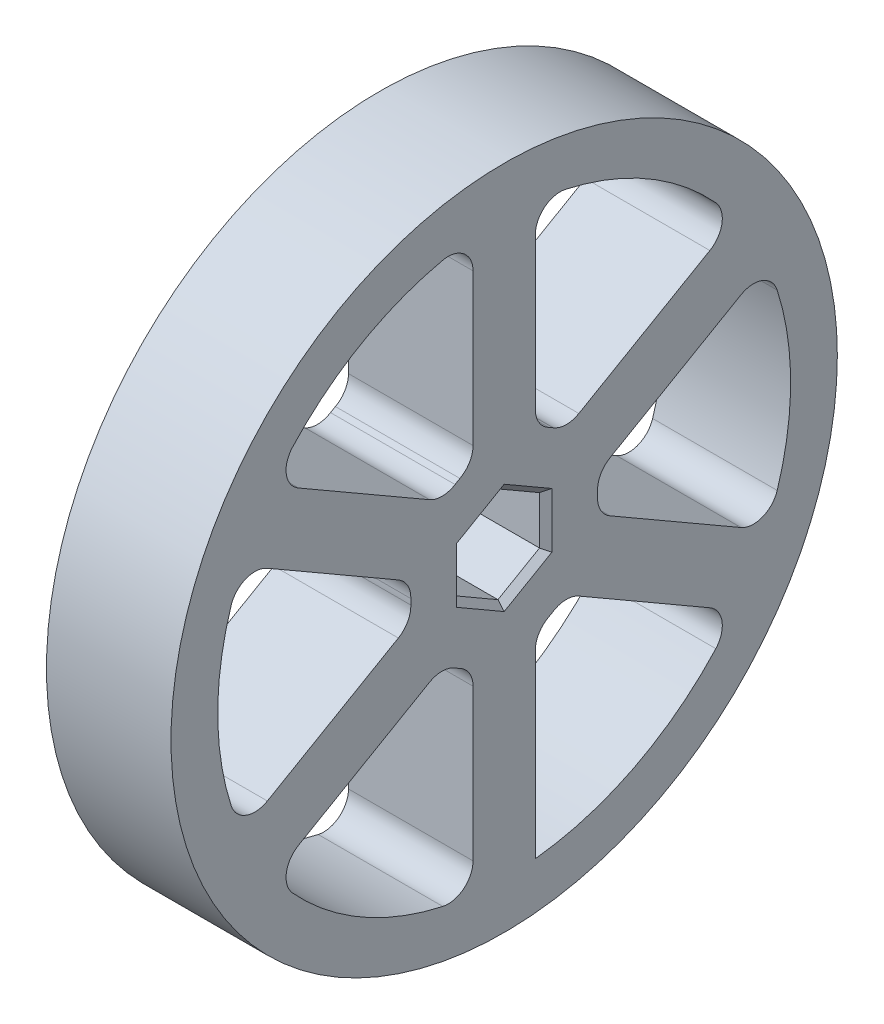
from build123d import *

# Parameters (mm, degrees)
AXLE_PROFILE_R              = 9.525
WHEEL_HUB_DEPTH             = 12.7
WHEEL_RIM_REACH             = 16.892
SKETCH3_R                   = 33.9725
SKETCH3_R_2                 = 29.21
WHEEL_RIM_DIRECTION_2_REACH = 16.892
SKETCH4_W                   = 6.35
SKETCH4_H                   = 20.229743879
BOSS_EXTRUDE1_DEPTH         = 12.7
SPOKES_COUNT                = 6
SPOKE_FILLETS_R             = 2.54
SHAFT_CHAMFERS_SIZE         = 0.635


with BuildPart() as part:
    # Axle Profile → Wheel Hub (new body)
    with BuildSketch(Plane(origin=(0, 0, 0), x_dir=(0, 0, -1), z_dir=(1, 0, 0))):
        Circle(AXLE_PROFILE_R)
        Polygon((0, -4.8895), (4.234431212, -2.44475), (4.234431212, 2.44475), (0, 4.8895), (-4.234431212, 2.44475), (-4.234431212, -2.44475), align=None, mode=Mode.SUBTRACT)
    extrude(amount=WHEEL_HUB_DEPTH)

    # Wheel Rim: up to this face of the body (flat: up to its plane)
    wheel_rim_end = Plane(part.part.faces().sort_by_distance((0, 0, 9.255592316))[0])
    # Sketch3 → Wheel Rim (add, up to the picked face)
    with BuildSketch(Plane.ZY.offset(-6.35), mode=Mode.PRIVATE) as wheel_rim_sk1:
        with Locations(Location((0, 0, 0), (0, 0, 180))):
            Circle(SKETCH3_R)
        with Locations(Location((0, 0, 0), (0, 0, 180))):
            Circle(SKETCH3_R_2, mode=Mode.SUBTRACT)
    wheel_rim_tool1 = split(extrude(wheel_rim_sk1.sketch, amount=WHEEL_RIM_REACH, mode=Mode.PRIVATE), bisect_by=wheel_rim_end, keep=Keep.BOTH, mode=Mode.PRIVATE)
    add(wheel_rim_tool1.solids().sort_by(Axis((6.35, 0, 33.011613), (-1, 0, 0)))[0])

    # Wheel Rim direction 2: up to this face of the body (flat: up to its plane)
    wheel_rim_direction_2_end = Plane(part.part.faces().sort_by_distance((12.7, 0, 9.255592316))[0])
    # Sketch3 → Wheel Rim direction 2 (add, up to the picked face)
    with BuildSketch(Plane.ZY.offset(-6.35), mode=Mode.PRIVATE) as wheel_rim_direction_2_sk1:
        with Locations(Location((0, 0, 0), (0, 0, 180))):
            Circle(SKETCH3_R)
        with Locations(Location((0, 0, 0), (0, 0, 180))):
            Circle(SKETCH3_R_2, mode=Mode.SUBTRACT)
    wheel_rim_direction_2_tool1 = split(extrude(wheel_rim_direction_2_sk1.sketch, amount=-WHEEL_RIM_DIRECTION_2_REACH, mode=Mode.PRIVATE), bisect_by=wheel_rim_direction_2_end, keep=Keep.BOTH, mode=Mode.PRIVATE)
    add(wheel_rim_direction_2_tool1.solids().sort_by(Axis((6.35, 0, 33.011613), (1, 0, 0)))[0])

    # Sketch4 → Boss-Extrude1 (add)
    with BuildSketch(Plane(origin=(12.7, 0, 0), x_dir=(0, 0, -1), z_dir=(1, 0, 0))):
        with Locations((0, 19.095128061)):
            Rectangle(SKETCH4_W, SKETCH4_H)
    boss_extrude1 = extrude(amount=-BOSS_EXTRUDE1_DEPTH)

    # Spokes: Boss-Extrude1 ×6 about axis
    spokes_axis = Axis((0, 0, 0), (1, 0, 0))
    for i in range(1, SPOKES_COUNT):
        add(boss_extrude1.rotate(spokes_axis, i * 360 / SPOKES_COUNT))

    # Spoke Fillets
    spoke_fillets_edges = [part.edges().sort_by_distance(p)[0] for p in [
        (6.35, 7.239758718, -6.189629933),
        (6.35, 1.740497404, -9.364629933),
        (6.35, -1.740497404, -9.364629933),
        (6.35, -7.239758718, -6.189629933),
        (6.35, -8.980256121, -3.175),
        (6.35, -8.980256121, 3.175),
        (6.35, -7.239758718, 6.189629933),
        (6.35, -1.740497404, 9.364629933),
        (6.35, 1.740497404, 9.364629933),
        (6.35, 7.239758718, 6.189629933),
        (6.35, 8.980256121, 3.175),
        (6.35, 8.980256121, -3.175),
        (9.525, 29.036932948, -3.175),
        (9.525, 29.036932948, 3.175),
        (3.175, 17.268097131, 23.559221581),
        (3.175, 11.768835817, 26.734221581),
        (9.525, -11.768835817, 26.734221581),
        (9.525, -17.268097131, 23.559221581),
        (9.525, -29.036932948, 3.175),
        (3.175, -17.268097131, -23.559221581),
        (3.175, -11.768835817, -26.734221581),
        (9.525, 11.768835817, -26.734221581),
        (3.175, 17.268097131, -23.559221581),
    ]]
    fillet(spoke_fillets_edges, radius=SPOKE_FILLETS_R)

    # Shaft Chamfers
    shaft_chamfers_edges = [part.edges().sort_by_distance(p)[0] for p in [
        (0, 0, -4.234431212),
        (0, 3.667125, -2.117215606),
        (0, 3.667125, 2.117215606),
        (0, 0, 4.234431212),
        (12.7, -3.667125, 2.117215606),
        (12.7, -3.667125, -2.117215606),
        (12.7, 0, -4.234431212),
        (12.7, 3.667125, -2.117215606),
        (12.7, 3.667125, 2.117215606),
        (12.7, 0, 4.234431212),
        (0, -3.667125, 2.117215606),
        (0, -3.667125, -2.117215606),
    ]]
    chamfer(shaft_chamfers_edges, length=SHAFT_CHAMFERS_SIZE)


solid = part.part
